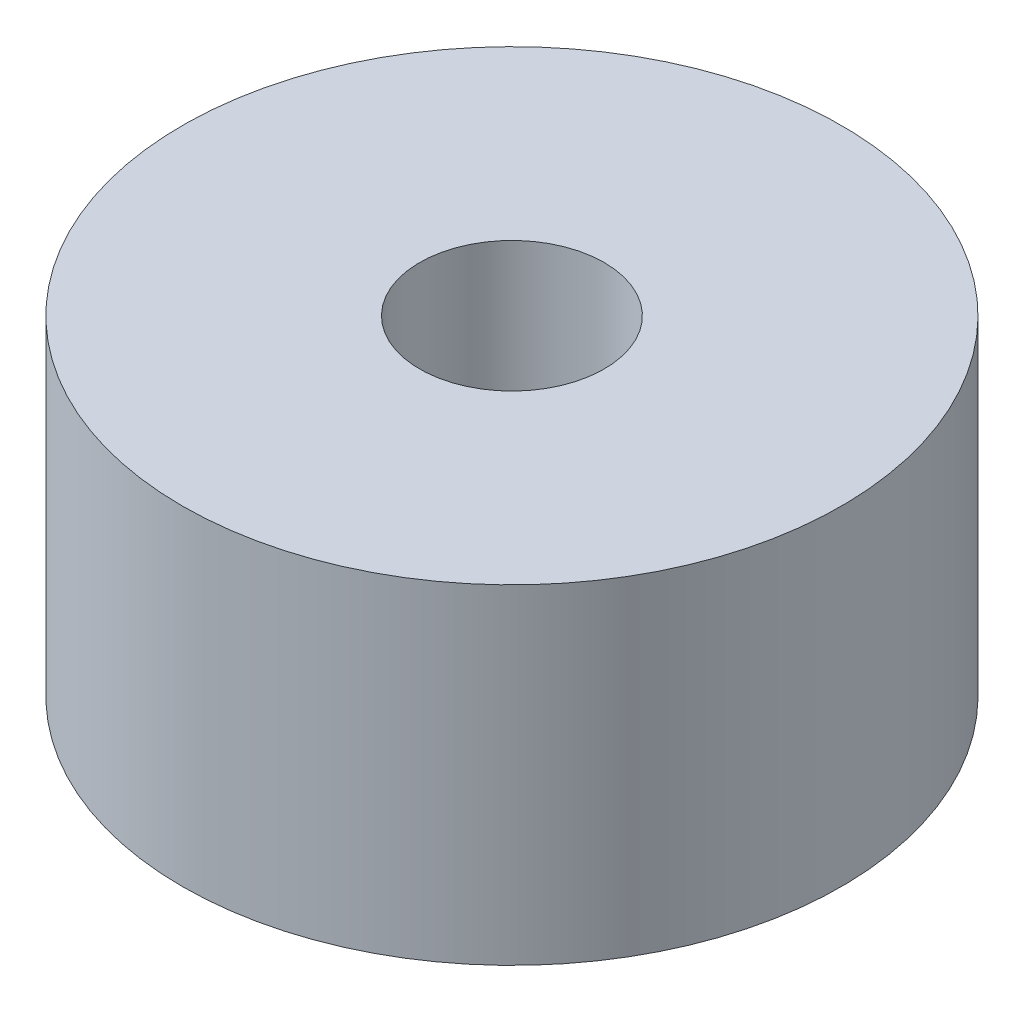
from build123d import *

# Parameters (mm, degrees)
ESQUISSE1_R             = 5
BOSS_EXTRU_1_DEPTH      = 5
ESQUISSE2_R             = 1.4
ENL_V_MAT_EXTRU_1_DEPTH = 7.7


with BuildPart() as part:
    # Esquisse1 → Boss.-Extru.1 (new body)
    with BuildSketch(Plane(origin=(0, 0, 0), x_dir=(1, 0, 0), z_dir=(0, 1, 0))):
        with Locations(Location((0, 0, 0), (0, 0, 270))):
            Circle(ESQUISSE1_R)
    extrude(amount=BOSS_EXTRU_1_DEPTH)

    # Esquisse2 → Enlèv. mat.-Extru.1 (cut)
    with BuildSketch(Plane.XZ):
        with Locations(Location((0, 0, 0), (0, 0, 270))):
            Circle(ESQUISSE2_R)
    extrude(amount=-ENL_V_MAT_EXTRU_1_DEPTH, mode=Mode.SUBTRACT)


solid = part.part
